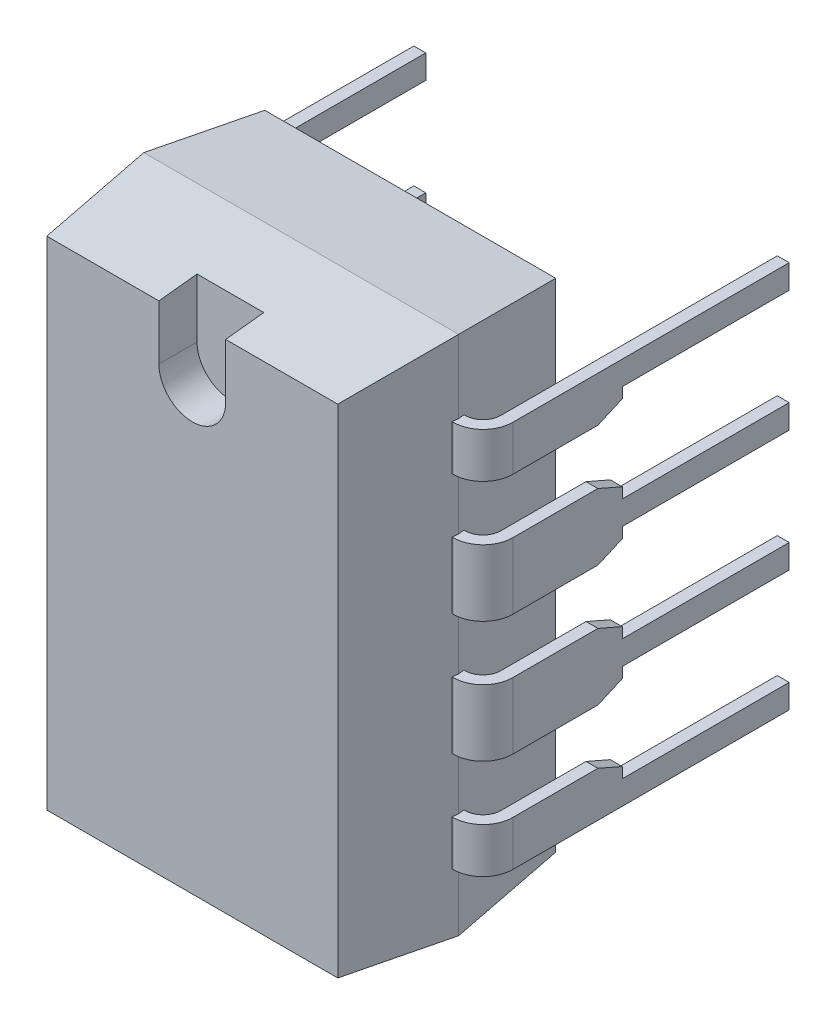
from build123d import *

# Parameters (mm, degrees)
BASIC_SHAPE_DEPTH              = 5.46
SIDE_PROFILE1_DEPTH            = 9.155243712
SIDE_PROFILE1_DEPTH_BACK       = 9.155243712
SIDE_PROFILE2_DEPTH            = 9.155243712
SIDE_PROFILE2_DEPTH_BACK       = 9.155243712
LOCATION_MARK_DEPTH            = 0.8
SKETCH6_W                      = 0.25
SKETCH6_H                      = 1.39
PIN_RELIEF_DEPTH               = 11.390535357
REMAINING_PINS_COUNT           = 4
REMAINING_PINS_PITCH           = 2.54
REMAINING_PINS_COPY_1_SKETCH_W = 0.25
REMAINING_PINS_COPY_1_SKETCH_H = 1.39
REMAINING_PINS_COPY_2_SKETCH_W = 0.25
REMAINING_PINS_COPY_2_SKETCH_H = 1.39
REMAINING_PINS_COPY_3_SKETCH_W = 0.25
REMAINING_PINS_COPY_3_SKETCH_H = 1.39
REMAINING_PINS_COPY_4_DEPTH    = 11.390535357
REMAINING_PINS_COPY_5_DEPTH    = 11.390535357
REMAINING_PINS_COPY_6_DEPTH    = 11.390535357
PIN_SHAPE1_DEPTH               = 0.445
PIN_SHAPE2_DEPTH               = 0.445


with BuildPart() as part:
    # Sketch1 → Basic Shape (new, symmetric)
    with BuildSketch(Plane(origin=(0, 0, 0), x_dir=(1, 0, 0), z_dir=(0, 1, 0))):
        Polygon((-3.05, -0.51), (-3.3, -2.795), (-3.05, -5.08), (3.05, -5.08), (3.3, -2.795), (3.05, -0.51), align=None)
    extrude(amount=BASIC_SHAPE_DEPTH, both=True)

    # Sketch2 → Side Profile1 (cut, two sides: drawn at the far end of the back side and taken through both)
    with BuildSketch(Plane(origin=(0, 0, 0), x_dir=(0, 0, -1), z_dir=(1, 0, 0)).offset(-SIDE_PROFILE1_DEPTH_BACK)):
        Polygon((-5.08, 5.46), (-5.08, 5.21), (-2.795, 5.46), align=None)
        Polygon((-5.08, -5.46), (-2.795, -5.46), (-5.08, -5.21), align=None)
    extrude(amount=SIDE_PROFILE1_DEPTH + SIDE_PROFILE1_DEPTH_BACK, mode=Mode.SUBTRACT)

    # Sketch3 → Side Profile2 (cut, two sides: drawn at the far end of the back side and taken through both)
    with BuildSketch(Plane(origin=(0, 0, 0), x_dir=(0, 0, -1), z_dir=(1, 0, 0)).offset(-SIDE_PROFILE2_DEPTH_BACK)):
        Polygon((-2.795, 5.46), (-0.51, 5.46), (-0.51, 5.21), align=None)
        Polygon((-2.795, -5.46), (-0.51, -5.46), (-0.51, -5.21), align=None)
    extrude(amount=SIDE_PROFILE2_DEPTH + SIDE_PROFILE2_DEPTH_BACK, mode=Mode.SUBTRACT)

    # Sketch4 → Location Mark (cut)
    with BuildSketch(Plane(origin=(0, 0, 5.08), x_dir=(-1, 0, 0), z_dir=(0, 0, -1))):
        with BuildLine():
            Line((0.7, 5.563480235), (0.7, 4.063480235))
            ThreePointArc((0.7, 4.063480235), (0, 3.363480235), (-0.7, 4.063480235))
            Line((-0.7, 4.063480235), (-0.7, 5.563480235))
            Line((-0.7, 5.563480235), (0.7, 5.563480235))
        make_face()
    extrude(amount=LOCATION_MARK_DEPTH, mode=Mode.SUBTRACT)

    # First Pin: sweep along a path in Sketch5
    with BuildLine(Plane(origin=(0, -3.94, 0), x_dir=(1, 0, 0), z_dir=(0, 1, 0))) as first_pin_path:
        Line((0, -2.795), (3.31, -2.795))
        ThreePointArc((3.31, -2.795), (3.663553391, -2.648553391), (3.81, -2.295))
        Line((3.81, -2.295), (3.81, 3.5))
    # Sketch6 → First Pin (sweep)
    with BuildSketch(Plane(origin=(0, 0, 0), x_dir=(0, 0, -1), z_dir=(1, 0, 0))):
        with Locations((-2.795, -3.94)):
            Rectangle(SKETCH6_W, SKETCH6_H)
    first_pin = sweep(path=first_pin_path.line)

    # Sketch7 → Pin Relief (cut, through all)
    with BuildSketch(Plane(origin=(3.935, 0, 0), x_dir=(0, 0, -1), z_dir=(1, 0, 0))):
        Polygon((0, -4.19), (3.5, -4.19), (3.5, -4.635), (-0.51, -4.635), (0, -4.4125), align=None)
        Polygon((0, -3.69), (3.5, -3.69), (3.5, -3.245), (-0.51, -3.245), (0, -3.4675), align=None)
    pin_relief = extrude(amount=-PIN_RELIEF_DEPTH, mode=Mode.SUBTRACT)

    # Opp Pin: First Pin, Pin Relief across plane
    add(first_pin.mirror(Plane(origin=(0, 0, 0), x_dir=(0, 0, 1), z_dir=(1, 0, 0))))
    add(pin_relief.mirror(Plane(origin=(0, 0, 0), x_dir=(0, 0, 1), z_dir=(1, 0, 0))), mode=Mode.SUBTRACT)

    # Remaining Pins: First Pin, Pin Relief ×4
    with Locations(*[(0, i * REMAINING_PINS_PITCH, 0) for i in range(1, REMAINING_PINS_COUNT)]):
        add(first_pin)
        add(pin_relief, mode=Mode.SUBTRACT)

    # Remaining Pins copy 1: sweep along a path in Remaining Pins copy 1 path
    with BuildLine(Plane(origin=(0, -1.4, 0), x_dir=(-1, 0, 0), z_dir=(0, 1, 0))) as remaining_pins_copy_1_path:
        Line((0, 2.795), (3.31, 2.795))
        ThreePointArc((3.31, 2.795), (3.663553391, 2.648553391), (3.81, 2.295))
        Line((3.81, 2.295), (3.81, -3.5))
    # Remaining Pins copy 1 sketch → Remaining Pins copy 1 (sweep)
    with BuildSketch(Plane(origin=(0, 2.54, 0), x_dir=(0, 0, -1), z_dir=(-1, 0, 0))):
        with Locations((-2.795, 3.94)):
            Rectangle(REMAINING_PINS_COPY_1_SKETCH_W, REMAINING_PINS_COPY_1_SKETCH_H)
    sweep(path=remaining_pins_copy_1_path.line)

    # Remaining Pins copy 2: sweep along a path in Remaining Pins copy 2 path
    with BuildLine(Plane(origin=(0, 1.14, 0), x_dir=(-1, 0, 0), z_dir=(0, 1, 0))) as remaining_pins_copy_2_path:
        Line((0, 2.795), (3.31, 2.795))
        ThreePointArc((3.31, 2.795), (3.663553391, 2.648553391), (3.81, 2.295))
        Line((3.81, 2.295), (3.81, -3.5))
    # Remaining Pins copy 2 sketch → Remaining Pins copy 2 (sweep)
    with BuildSketch(Plane(origin=(0, 5.08, 0), x_dir=(0, 0, -1), z_dir=(-1, 0, 0))):
        with Locations((-2.795, 3.94)):
            Rectangle(REMAINING_PINS_COPY_2_SKETCH_W, REMAINING_PINS_COPY_2_SKETCH_H)
    sweep(path=remaining_pins_copy_2_path.line)

    # Remaining Pins copy 3: sweep along a path in Remaining Pins copy 3 path
    with BuildLine(Plane(origin=(0, 3.68, 0), x_dir=(-1, 0, 0), z_dir=(0, 1, 0))) as remaining_pins_copy_3_path:
        Line((0, 2.795), (3.31, 2.795))
        ThreePointArc((3.31, 2.795), (3.663553391, 2.648553391), (3.81, 2.295))
        Line((3.81, 2.295), (3.81, -3.5))
    # Remaining Pins copy 3 sketch → Remaining Pins copy 3 (sweep)
    with BuildSketch(Plane(origin=(0, 7.62, 0), x_dir=(0, 0, -1), z_dir=(-1, 0, 0))):
        with Locations((-2.795, 3.94)):
            Rectangle(REMAINING_PINS_COPY_3_SKETCH_W, REMAINING_PINS_COPY_3_SKETCH_H)
    sweep(path=remaining_pins_copy_3_path.line)

    # Remaining Pins copy 4 sketch → Remaining Pins copy 4 (cut, through all)
    with BuildSketch(Plane(origin=(-3.935, 2.54, 0), x_dir=(0, 0, -1), z_dir=(-1, 0, 0))):
        Polygon((0, 4.19), (3.5, 4.19), (3.5, 4.635), (-0.51, 4.635), (0, 4.4125), align=None)
        Polygon((0, 3.69), (3.5, 3.69), (3.5, 3.245), (-0.51, 3.245), (0, 3.4675), align=None)
    extrude(amount=-REMAINING_PINS_COPY_4_DEPTH, mode=Mode.SUBTRACT)

    # Remaining Pins copy 5 sketch → Remaining Pins copy 5 (cut, through all)
    with BuildSketch(Plane(origin=(-3.935, 5.08, 0), x_dir=(0, 0, -1), z_dir=(-1, 0, 0))):
        Polygon((0, 4.19), (3.5, 4.19), (3.5, 4.635), (-0.51, 4.635), (0, 4.4125), align=None)
        Polygon((0, 3.69), (3.5, 3.69), (3.5, 3.245), (-0.51, 3.245), (0, 3.4675), align=None)
    extrude(amount=-REMAINING_PINS_COPY_5_DEPTH, mode=Mode.SUBTRACT)

    # Remaining Pins copy 6 sketch → Remaining Pins copy 6 (cut, through all)
    with BuildSketch(Plane(origin=(-3.935, 7.62, 0), x_dir=(0, 0, -1), z_dir=(-1, 0, 0))):
        Polygon((0, 4.19), (3.5, 4.19), (3.5, 4.635), (-0.51, 4.635), (0, 4.4125), align=None)
        Polygon((0, 3.69), (3.5, 3.69), (3.5, 3.245), (-0.51, 3.245), (0, 3.4675), align=None)
    extrude(amount=-REMAINING_PINS_COPY_6_DEPTH, mode=Mode.SUBTRACT)

    # Sketch9 → Pin Shape1 (cut)
    with BuildSketch(Plane.XZ.offset(4.635)):
        with BuildLine():
            Line((3.935, 0), (3.685, 0))
            Line((3.685, 0), (3.685, 2.295))
            ThreePointArc((3.685, 2.295), (3.575165043, 2.560165043), (3.31, 2.67))
            Line((3.31, 2.67), (3.286323851, 2.67))
            Line((3.286323851, 2.67), (3.3, 2.795))
            Line((3.3, 2.795), (3.286323851, 2.92))
            Line((3.286323851, 2.92), (3.31, 2.92))
            ThreePointArc((3.31, 2.92), (3.751941738, 2.736941738), (3.935, 2.295))
            Line((3.935, 2.295), (3.935, 0))
        make_face()
        with BuildLine():
            Line((-3.685, 0), (-3.935, 0))
            Line((-3.935, 0), (-3.935, 2.295))
            ThreePointArc((-3.935, 2.295), (-3.751941738, 2.736941738), (-3.31, 2.92))
            Line((-3.31, 2.92), (-3.286323851, 2.92))
            Line((-3.286323851, 2.92), (-3.3, 2.795))
            Line((-3.3, 2.795), (-3.286323851, 2.67))
            Line((-3.286323851, 2.67), (-3.31, 2.67))
            ThreePointArc((-3.31, 2.67), (-3.575165043, 2.560165043), (-3.685, 2.295))
            Line((-3.685, 2.295), (-3.685, 0))
        make_face()
    extrude(amount=-PIN_SHAPE1_DEPTH, mode=Mode.SUBTRACT)

    # Sketch10 → Pin Shape2 (cut)
    with BuildSketch(Plane(origin=(0, 4.375, 0), x_dir=(-1, 0, 0), z_dir=(0, 1, 0))):
        with BuildLine():
            Line((3.685, 0), (3.935, 0))
            Line((3.935, 0), (3.935, 2.295))
            ThreePointArc((3.935, 2.295), (3.751941738, 2.736941738), (3.31, 2.92))
            Line((3.31, 2.92), (3.286323851, 2.92))
            Line((3.286323851, 2.92), (3.3, 2.795))
            Line((3.3, 2.795), (3.286323851, 2.67))
            Line((3.286323851, 2.67), (3.31, 2.67))
            ThreePointArc((3.31, 2.67), (3.575165043, 2.560165043), (3.685, 2.295))
            Line((3.685, 2.295), (3.685, 0))
        make_face()
        with BuildLine():
            Line((-3.685, 0), (-3.935, 0))
            Line((-3.935, 0), (-3.935, 2.295))
            ThreePointArc((-3.935, 2.295), (-3.751941738, 2.736941738), (-3.31, 2.92))
            Line((-3.31, 2.92), (-3.286323851, 2.92))
            Line((-3.286323851, 2.92), (-3.3, 2.795))
            Line((-3.3, 2.795), (-3.286323851, 2.67))
            Line((-3.286323851, 2.67), (-3.31, 2.67))
            ThreePointArc((-3.31, 2.67), (-3.575165043, 2.560165043), (-3.685, 2.295))
            Line((-3.685, 2.295), (-3.685, 0))
        make_face()
    extrude(amount=-PIN_SHAPE2_DEPTH, mode=Mode.SUBTRACT)


solid = part.part
